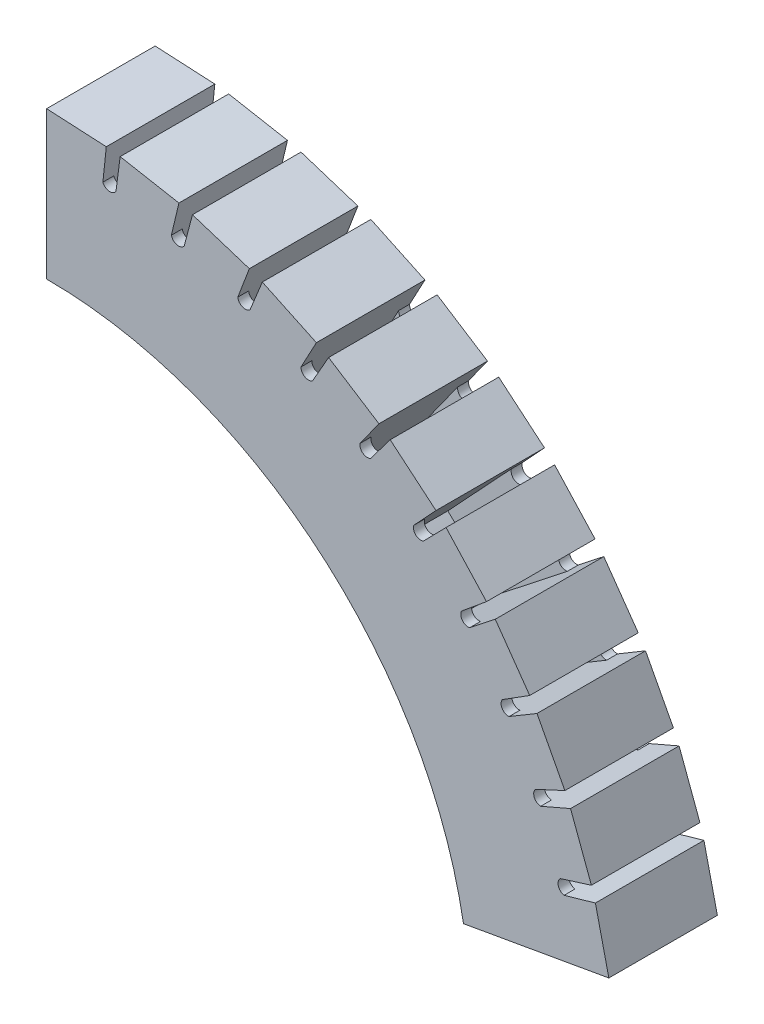
from build123d import *

# Parameters (mm, degrees)
AUFSATZ_LINEAR_AUSTRAGEN1_DEPTH = 5
AUFSATZ_LINEAR_AUSTRAGEN2_DEPTH = 5
KREISMUSTER1_COUNT              = 11
KREISMUSTER1_ANGLE              = 74
AUFSATZ_LINEAR_AUSTRAGEN3_DEPTH = 5
AUFSATZ_LINEAR_AUSTRAGEN4_DEPTH = 1
KREISMUSTER2_COUNT              = 10
KREISMUSTER2_ANGLE              = 66.6
KREISMUSTER2_COPY_1_DEPTH       = 1
KREISMUSTER2_COPY_2_DEPTH       = 1
KREISMUSTER2_COPY_3_DEPTH       = 1
KREISMUSTER2_COPY_4_DEPTH       = 1
KREISMUSTER2_COPY_5_DEPTH       = 1
KREISMUSTER2_COPY_6_DEPTH       = 1
KREISMUSTER2_COPY_7_DEPTH       = 1
KREISMUSTER2_COPY_8_DEPTH       = 1
KREISMUSTER2_COPY_9_DEPTH       = 1


with BuildPart() as part:
    # Skizze1 → Aufsatz-Linear austragen1 (new, symmetric)
    with BuildSketch(Plane.XY):
        with BuildLine():
            Line((0, 41), (0, 40))
            ThreePointArc((0, 40), (25.711504387, 30.641777725), (39.39231012, 6.945927107))
            Line((39.39231012, 6.945927107), (40.377117874, 7.119575284))
            ThreePointArc((40.377117874, 7.119575284), (26.354291997, 31.407822168), (0, 41))
        make_face()
    extrude(amount=AUFSATZ_LINEAR_AUSTRAGEN1_DEPTH, both=True)

    # Skizze2 → Aufsatz-Linear austragen2 (add, symmetric)
    with BuildSketch(Plane.XY):
        with BuildLine():
            Line((0, 52.6), (0, 41))
            ThreePointArc((0, 41), (2.145774206, 40.943810925), (4.285666994, 40.77539771))
            Line((4.285666994, 40.77539771), (5.498197168, 52.311851696))
            Line((5.498197168, 52.311851696), (0, 52.6))
        make_face()
    aufsatz_linear_austragen2 = extrude(amount=AUFSATZ_LINEAR_AUSTRAGEN2_DEPTH, both=True)

    # Kreismuster1: Aufsatz-Linear austragen2 ×11 about axis
    kreismuster1_axis = Axis((0, 0, -5.5), (0, 0, -1))
    for i in range(1, KREISMUSTER1_COUNT):
        add(aufsatz_linear_austragen2.rotate(kreismuster1_axis, i * KREISMUSTER1_ANGLE / (KREISMUSTER1_COUNT - 1)))

    # Skizze3 → Aufsatz-Linear austragen3 (add, symmetric)
    with BuildSketch(Plane.XY):
        with BuildLine():
            ThreePointArc((39.39231012, 6.945927107), (25.711504387, 30.641777725), (0, 40))
            Line((0, 40), (0, 39))
            ThreePointArc((0, 39), (25.068716778, 29.875733282), (38.407502367, 6.772278929))
            Line((38.407502367, 6.772278929), (39.39231012, 6.945927107))
        make_face()
    extrude(amount=AUFSATZ_LINEAR_AUSTRAGEN3_DEPTH, both=True)

    # Skizze4 → Aufsatz-Linear austragen4 (add)
    with BuildSketch(Plane(origin=(0, 0, -5), x_dir=(-1, 0, 0), z_dir=(0, 0, -1))):
        with BuildLine():
            Line((-47.678364885, 13.671551131), (-39.411729533, 11.301131588))
            Line((-39.411729533, 11.301131588), (-39.123853469, 12.260672482))
            Line((-39.123853469, 12.260672482), (-47.330106633, 14.832356338))
            ThreePointArc((-47.330106633, 14.832356338), (-47.149949209, 14.145662676), (-47.678364885, 13.671551131))
        make_face()
    aufsatz_linear_austragen4 = extrude(amount=-AUFSATZ_LINEAR_AUSTRAGEN4_DEPTH)

    # Spiegeln1: Aufsatz-Linear austragen4 across plane
    add(aufsatz_linear_austragen4.mirror(Plane.XY))

    # Kreismuster2: Aufsatz-Linear austragen4 ×10 about axis
    kreismuster2_axis = Axis((0, 0, -5.5), (0, 0, 1))
    for i in range(1, KREISMUSTER2_COUNT):
        add(aufsatz_linear_austragen4.rotate(kreismuster2_axis, i * KREISMUSTER2_ANGLE / (KREISMUSTER2_COUNT - 1)))

    # Kreismuster2 copy 1 sketch → Kreismuster2 copy 1 (add)
    with BuildSketch(Plane(origin=(0, 0, 5), x_dir=(-0.9916711623830904, -0.12879559657756307, 0), z_dir=(0, 0, 1))):
        with BuildLine():
            Line((-47.678364885, -13.671551131), (-39.411729533, -11.301131588))
            Line((-39.411729533, -11.301131588), (-39.123853469, -12.260672482))
            Line((-39.123853469, -12.260672482), (-47.330106633, -14.832356338))
            ThreePointArc((-47.330106633, -14.832356338), (-47.149949209, -14.145662676), (-47.678364885, -13.671551131))
        make_face()
    extrude(amount=-KREISMUSTER2_COPY_1_DEPTH)

    # Kreismuster2 copy 2 sketch → Kreismuster2 copy 2 (add)
    with BuildSketch(Plane(origin=(0, 0, 5), x_dir=(-0.9668233886044593, -0.2554457579357911, 0), z_dir=(0, 0, 1))):
        with BuildLine():
            Line((-47.678364885, -13.671551131), (-39.411729533, -11.301131588))
            Line((-39.411729533, -11.301131588), (-39.123853469, -12.260672482))
            Line((-39.123853469, -12.260672482), (-47.330106633, -14.832356338))
            ThreePointArc((-47.330106633, -14.832356338), (-47.149949209, -14.145662676), (-47.678364885, -13.671551131))
        make_face()
    extrude(amount=-KREISMUSTER2_COPY_2_DEPTH)

    # Kreismuster2 copy 3 sketch → Kreismuster2 copy 3 (add)
    with BuildSketch(Plane(origin=(0, 0, 5), x_dir=(-0.9258705848099944, -0.37784078681846794, 0), z_dir=(0, 0, 1))):
        with BuildLine():
            Line((-47.678364885, -13.671551131), (-39.411729533, -11.301131588))
            Line((-39.411729533, -11.301131588), (-39.123853469, -12.260672482))
            Line((-39.123853469, -12.260672482), (-47.330106633, -14.832356338))
            ThreePointArc((-47.330106633, -14.832356338), (-47.149949209, -14.145662676), (-47.678364885, -13.671551131))
        make_face()
    extrude(amount=-KREISMUSTER2_COPY_3_DEPTH)

    # Kreismuster2 copy 4 sketch → Kreismuster2 copy 4 (add)
    with BuildSketch(Plane(origin=(0, 0, 5), x_dir=(-0.8694949295052185, -0.493941866584232, 0), z_dir=(0, 0, 1))):
        with BuildLine():
            Line((-47.678364885, -13.671551131), (-39.411729533, -11.301131588))
            Line((-39.411729533, -11.301131588), (-39.123853469, -12.260672482))
            Line((-39.123853469, -12.260672482), (-47.330106633, -14.832356338))
            ThreePointArc((-47.330106633, -14.832356338), (-47.149949209, -14.145662676), (-47.678364885, -13.671551131))
        make_face()
    extrude(amount=-KREISMUSTER2_COPY_4_DEPTH)

    # Kreismuster2 copy 5 sketch → Kreismuster2 copy 5 (add)
    with BuildSketch(Plane(origin=(0, 0, 5), x_dir=(-0.7986355100472919, -0.6018150231520494, 0), z_dir=(0, 0, 1))):
        with BuildLine():
            Line((-47.678364885, -13.671551131), (-39.411729533, -11.301131588))
            Line((-39.411729533, -11.301131588), (-39.123853469, -12.260672482))
            Line((-39.123853469, -12.260672482), (-47.330106633, -14.832356338))
            ThreePointArc((-47.330106633, -14.832356338), (-47.149949209, -14.145662676), (-47.678364885, -13.671551131))
        make_face()
    extrude(amount=-KREISMUSTER2_COPY_5_DEPTH)

    # Kreismuster2 copy 6 sketch → Kreismuster2 copy 6 (add)
    with BuildSketch(Plane(origin=(0, 0, 5), x_dir=(-0.7144726796328021, -0.6996633405133666, 0), z_dir=(0, 0, 1))):
        with BuildLine():
            Line((-47.678364885, -13.671551131), (-39.411729533, -11.301131588))
            Line((-39.411729533, -11.301131588), (-39.123853469, -12.260672482))
            Line((-39.123853469, -12.260672482), (-47.330106633, -14.832356338))
            ThreePointArc((-47.330106633, -14.832356338), (-47.149949209, -14.145662676), (-47.678364885, -13.671551131))
        make_face()
    extrude(amount=-KREISMUSTER2_COPY_6_DEPTH)

    # Kreismuster2 copy 7 sketch → Kreismuster2 copy 7 (add)
    with BuildSketch(Plane(origin=(0, 0, 5), x_dir=(-0.6184083953575527, -0.7858568931754031, 0), z_dir=(0, 0, 1))):
        with BuildLine():
            Line((-47.678364885, -13.671551131), (-39.411729533, -11.301131588))
            Line((-39.411729533, -11.301131588), (-39.123853469, -12.260672482))
            Line((-39.123853469, -12.260672482), (-47.330106633, -14.832356338))
            ThreePointArc((-47.330106633, -14.832356338), (-47.149949209, -14.145662676), (-47.678364885, -13.671551131))
        make_face()
    extrude(amount=-KREISMUSTER2_COPY_7_DEPTH)

    # Kreismuster2 copy 8 sketch → Kreismuster2 copy 8 (add)
    with BuildSketch(Plane(origin=(0, 0, 5), x_dir=(-0.5120428648705696, -0.8589598969306655, 0), z_dir=(0, 0, 1))):
        with BuildLine():
            Line((-47.678364885, -13.671551131), (-39.411729533, -11.301131588))
            Line((-39.411729533, -11.301131588), (-39.123853469, -12.260672482))
            Line((-39.123853469, -12.260672482), (-47.330106633, -14.832356338))
            ThreePointArc((-47.330106633, -14.832356338), (-47.149949209, -14.145662676), (-47.678364885, -13.671551131))
        make_face()
    extrude(amount=-KREISMUSTER2_COPY_8_DEPTH)

    # Kreismuster2 copy 9 sketch → Kreismuster2 copy 9 (add)
    with BuildSketch(Plane(origin=(0, 0, 5), x_dir=(-0.3971478906347781, -0.9177546256839823, 0), z_dir=(0, 0, 1))):
        with BuildLine():
            Line((-47.678364885, -13.671551131), (-39.411729533, -11.301131588))
            Line((-39.411729533, -11.301131588), (-39.123853469, -12.260672482))
            Line((-39.123853469, -12.260672482), (-47.330106633, -14.832356338))
            ThreePointArc((-47.330106633, -14.832356338), (-47.149949209, -14.145662676), (-47.678364885, -13.671551131))
        make_face()
    extrude(amount=-KREISMUSTER2_COPY_9_DEPTH)


solid = part.part
